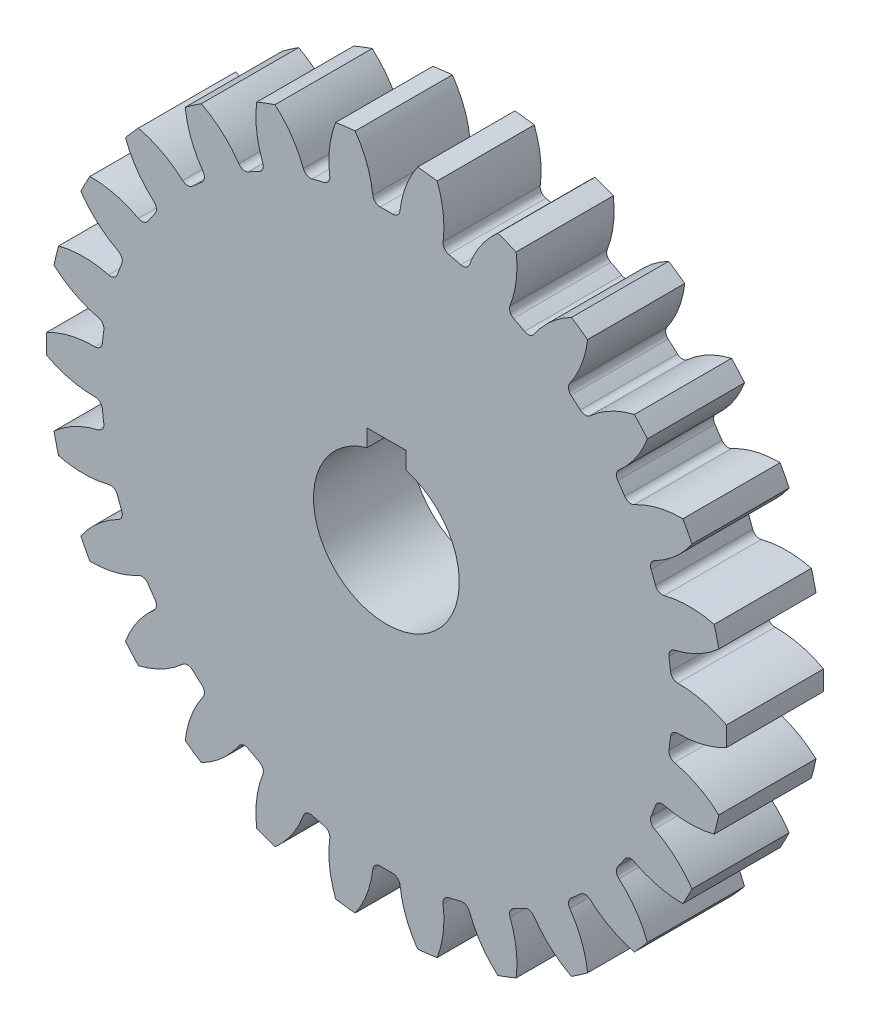
from build123d import *

# Parameters (mm, degrees)
SKETCH1_R                = 70
BOSS_EXTRUDE1_DEPTH      = 20
CUT_EXTRUDE3_DEPTH       = 101.995049384
FILLET1_R                = 1.5
CIRPATTERN1_COUNT        = 26
FILLET1_OF_CIRPATTERN1_R = 1.5


with BuildPart() as part:
    # Sketch1 → Boss-Extrude1 (new body)
    with BuildSketch(Plane.XY):
        Circle(SKETCH1_R)
        with BuildLine():
            Line((-4, 14.456832295), (-4, 18))
            Line((-4, 18), (4, 18))
            Line((4, 18), (4, 14.456832295))
            ThreePointArc((4, 14.456832295), (0, -15), (-4, 14.456832295))
        make_face(mode=Mode.SUBTRACT)
    extrude(amount=BOSS_EXTRUDE1_DEPTH)

    # Sketch2 → Cut-Extrude3 (cut, through all)
    with BuildSketch(Plane.XY):
        with BuildLine():
            ThreePointArc((-7.126756228, 70.641413814), (-3.972593373, 65.011912999), (-2.686001796, 58.688566982))
            ThreePointArc((-2.686001796, 58.688566982), (0, 58.75), (2.686001796, 58.688566982))
            ThreePointArc((2.686001796, 58.688566982), (3.972593373, 65.011912999), (7.126756228, 70.641413814))
            ThreePointArc((7.126756228, 70.641413814), (0, 71), (-7.126756228, 70.641413814))
        make_face()
    cut_extrude3 = extrude(amount=CUT_EXTRUDE3_DEPTH, mode=Mode.SUBTRACT)

    # Fillet1
    fillet1_edges = [part.edges().sort_by_distance(p)[0] for p in [
        (2.686001796, 58.688566982, 10),
        (-2.686001796, 58.688566982, 10),
    ]]
    fillet(fillet1_edges, radius=FILLET1_R)

    # CirPattern1: Cut-Extrude3 ×26 about axis
    cirpattern1_axis = Axis((0, 0, 0), (0, 0, 1))
    for i in range(1, CIRPATTERN1_COUNT):
        add(cut_extrude3.rotate(cirpattern1_axis, i * 360 / CIRPATTERN1_COUNT), mode=Mode.SUBTRACT)

    # Fillet1 of CirPattern1
    fillet1_of_cirpattern1_edges = [part.edges().sort_by_distance(p)[0] for p in [
        (-11.437141928, 57.625986191, 10),
        (-16.653044859, 56.340381583, 10),
        (-24.895600535, 53.214392545, 10),
        (-29.652273485, 50.717897996, 10),
        (-36.907217331, 45.710171831, 10),
        (-40.928219759, 42.14787453, 10),
        (-46.773920808, 35.54944208, 10),
        (-49.825566668, 31.128369797, 10),
        (-53.922294024, 23.322707972, 10),
        (-55.827232751, 18.299797358, 10),
        (-57.936899511, 9.740542851, 10),
        (-58.58442299, 4.407707214, 10),
        (-58.58442299, -4.407707214, 10),
        (-57.936899511, -9.740542851, 10),
        (-55.827232751, -18.299797358, 10),
        (-53.922294024, -23.322707972, 10),
        (-49.825566668, -31.128369797, 10),
        (-46.773920808, -35.54944208, 10),
        (-40.928219759, -42.14787453, 10),
        (-36.907217331, -45.710171831, 10),
        (-29.652273485, -50.717897996, 10),
        (-24.895600535, -53.214392545, 10),
        (-16.653044859, -56.340381583, 10),
        (-11.437141928, -57.625986191, 10),
        (-2.686001796, -58.688566982, 10),
        (2.686001796, -58.688566982, 10),
        (11.437141928, -57.625986191, 10),
        (16.653044859, -56.340381583, 10),
        (24.895600535, -53.214392545, 10),
        (29.652273485, -50.717897996, 10),
        (36.907217331, -45.710171831, 10),
        (40.928219759, -42.14787453, 10),
        (46.773920808, -35.54944208, 10),
        (49.825566668, -31.128369797, 10),
        (53.922294024, -23.322707972, 10),
        (55.827232751, -18.299797358, 10),
        (57.936899511, -9.740542851, 10),
        (58.58442299, -4.407707214, 10),
        (58.58442299, 4.407707214, 10),
        (57.936899511, 9.740542851, 10),
        (55.827232751, 18.299797358, 10),
        (53.922294024, 23.322707972, 10),
        (49.825566668, 31.128369797, 10),
        (46.773920808, 35.54944208, 10),
        (40.928219759, 42.14787453, 10),
        (36.907217331, 45.710171831, 10),
        (29.652273485, 50.717897996, 10),
        (24.895600535, 53.214392545, 10),
        (16.653044859, 56.340381583, 10),
        (11.437141928, 57.625986191, 10),
    ]]
    fillet(fillet1_of_cirpattern1_edges, radius=FILLET1_OF_CIRPATTERN1_R)


solid = part.part
